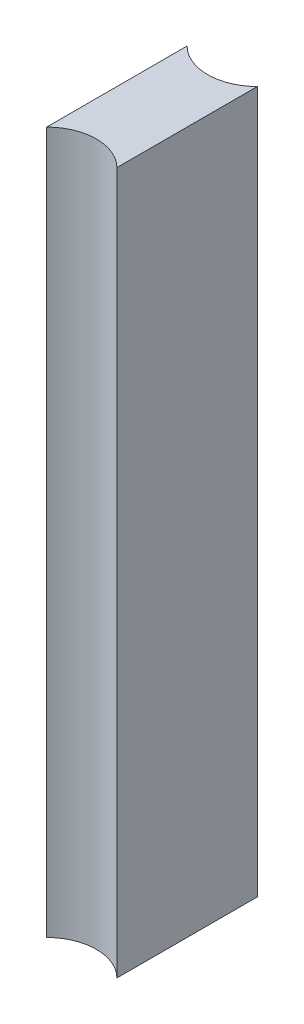
from build123d import *

# Parameters (mm, degrees)
BOSS_EXTRUDE1_DEPTH = 1.5


with BuildPart() as part:
    # Sketch1 → Boss-Extrude1 (new body)
    with BuildSketch(Plane(origin=(0, 0, 0), x_dir=(1, 0, 0), z_dir=(0, 1, 0))):
        with BuildLine():
            Line((-0.075, 0.15), (-0.075, -0.15))
            ThreePointArc((-0.075, -0.15), (0, -0.118933983), (0.075, -0.15))
            Line((0.075, -0.15), (0.075, 0.15))
            ThreePointArc((0.075, 0.15), (0, 0.118933983), (-0.075, 0.15))
        make_face()
    extrude(amount=BOSS_EXTRUDE1_DEPTH)


solid = part.part
